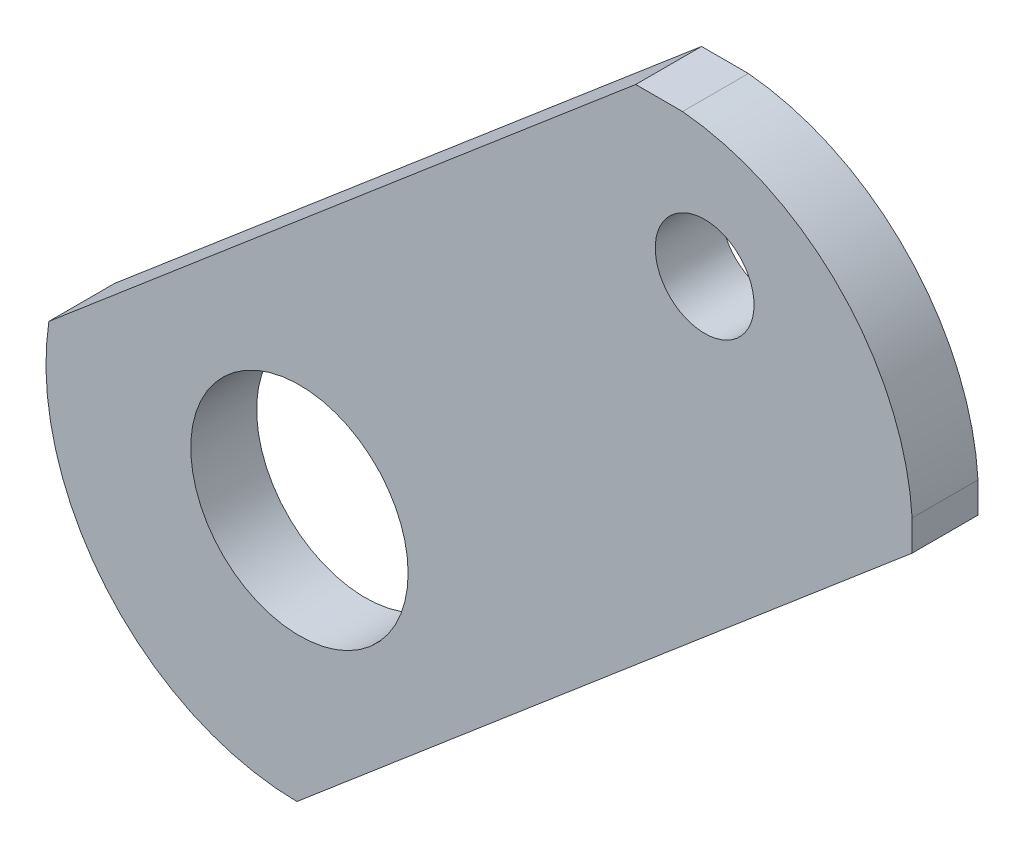
from build123d import *

# Parameters (mm, degrees)
SKETCH1_W           = 38.1
SKETCH1_H           = 30.48
BOSS_EXTRUDE1_DEPTH = 2.54
SKETCH2_R           = 1.905
SKETCH2_R_2         = 4.191
CUT_EXTRUDE1_DEPTH  = 49.857875517
CUT_EXTRUDE3_DEPTH  = 2.54
CUT_EXTRUDE4_DEPTH  = 2.54
CUT_EXTRUDE5_DEPTH  = 2.54


with BuildPart() as part:
    # Sketch1 → Boss-Extrude1 (new body)
    with BuildSketch(Plane.XY):
        with Locations((-19.05, -15.24)):
            Rectangle(SKETCH1_W, SKETCH1_H)
    extrude(amount=BOSS_EXTRUDE1_DEPTH)

    # Sketch2 → Cut-Extrude1 (cut, through all)
    with BuildSketch(Plane.XY.offset(2.54)):
        with Locations((-8.001, -5.08)):
            Circle(SKETCH2_R)
        with Locations((-23.626645651, -20.705645651)):
            Circle(SKETCH2_R_2)
    extrude(amount=-CUT_EXTRUDE1_DEPTH, mode=Mode.SUBTRACT)

    # Sketch3 → Cut-Extrude3 (cut)
    with BuildSketch(Plane.XY.offset(2.54)):
        Polygon((0, -10.322504019), (-23.72616594, -30.48), (0, -30.48), align=None)
        Polygon((-38.1, 0), (-10.660565369, 0), (-38.1, -23.312249215), align=None)
    extrude(amount=-CUT_EXTRUDE3_DEPTH, mode=Mode.SUBTRACT)

    # Sketch4 → Cut-Extrude4 (cut)
    with BuildSketch(Plane.XY.offset(2.54)):
        with BuildLine():
            Line((-38.1, -23.312249215), (-38.1, -30.48))
            Line((-38.1, -30.48), (-23.72616594, -30.48))
            ThreePointArc((-23.72616594, -30.479999994), (-31.076006206, -27.034542439), (-33.288651039, -19.224578768))
            Line((-33.288651039, -19.224578768), (-38.1, -23.312249215))
        make_face()
    extrude(amount=-CUT_EXTRUDE4_DEPTH, mode=Mode.SUBTRACT)

    # Sketch5 → Cut-Extrude5 (cut)
    with BuildSketch(Plane.XY.offset(2.54)):
        with BuildLine():
            Line((0, 0), (-8.85357425, 0))
            ThreePointArc((-8.85357425, 0), (-2.73475248, -2.933386248), (0, -9.143528244))
            Line((0, -9.143528244), (0, 0))
        make_face()
    extrude(amount=-CUT_EXTRUDE5_DEPTH, mode=Mode.SUBTRACT)


solid = part.part
